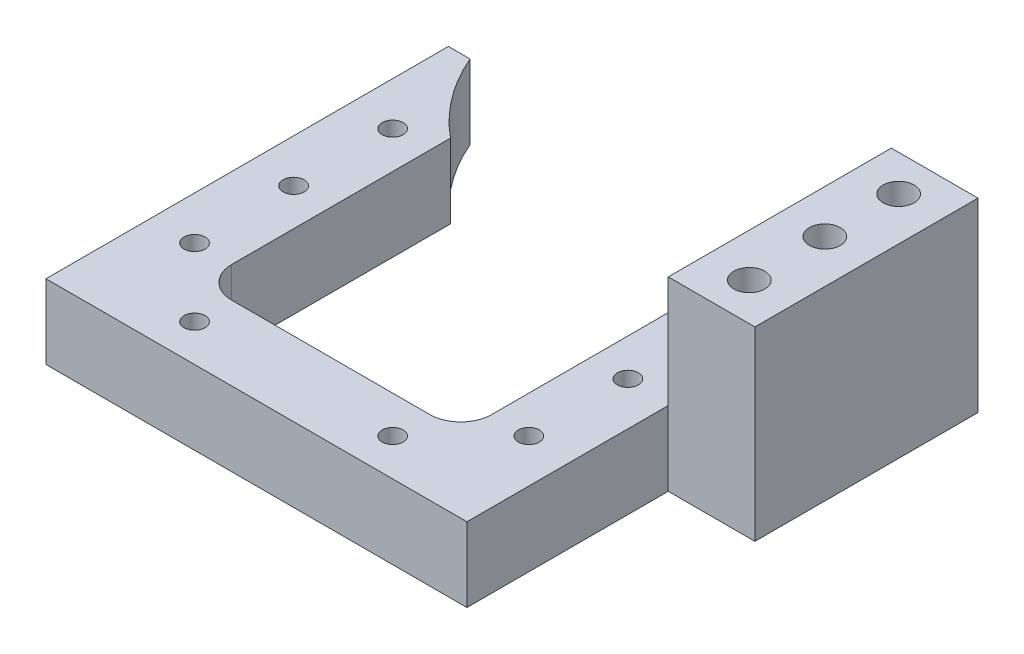
from build123d import *

# Parameters (mm, degrees)
SKETCH1_R           = 0.85
BOSS_EXTRUDE1_DEPTH = 6
BOSS_EXTRUDE2_DEPTH = 15
SKETCH4_R           = 1.25
CUT_EXTRUDE2_DEPTH  = 49.187135213
CUT_EXTRUDE3_DEPTH  = 10
SKETCH7_W           = 1.75
SKETCH7_H           = 1.777688456
BOSS_EXTRUDE4_DEPTH = 6


with BuildPart() as part:
    # Sketch1 → Boss-Extrude1 (new body)
    with BuildSketch(Plane(origin=(0, 0, 0), x_dir=(1, 0, 0), z_dir=(0, 1, 0))):
        with BuildLine():
            Line((-17, -6.5), (-17, -33.5))
            Line((-17, -33.5), (-17, -39))
            Line((-17, -39), (17, -39))
            Line((17, -39), (17, -33.5))
            Line((17, -33.5), (17, -6.5))
            Line((17, -6.5), (15.25, -6.5))
            ThreePointArc((15.25, -6.5), (13.258096668, -9.951651759), (10.5, -12.828191611))
            Line((10.5, -12.828191611), (10.5, -30.5))
            Line((10.5, -30.5), (8, -30.5))
            Line((8, -30.5), (8, -33))
            Line((8, -33), (-8, -33))
            Line((-8, -33), (-8, -30.5))
            Line((-8, -30.5), (-10.5, -30.5))
            Line((-10.5, -30.5), (-10.5, -12.828191611))
            ThreePointArc((-10.5, -12.828191611), (-13.258096668, -9.951651759), (-15.25, -6.5))
            Line((-15.25, -6.5), (-17, -6.5))
        make_face()
        with Locations(Location((-13.5, -30.5, 0), (0, 0, 270))):
            Circle(SKETCH1_R, mode=Mode.SUBTRACT)
        with Locations(Location((-13.5, -22.5, 0), (0, 0, 270))):
            Circle(SKETCH1_R, mode=Mode.SUBTRACT)
        with Locations(Location((-13.5, -14.5, 0), (0, 0, 270))):
            Circle(SKETCH1_R, mode=Mode.SUBTRACT)
        with Locations(Location((-8, -36, 0), (0, 0, 270))):
            Circle(SKETCH1_R, mode=Mode.SUBTRACT)
        with Locations(Location((8, -36, 0), (0, 0, 270))):
            Circle(SKETCH1_R, mode=Mode.SUBTRACT)
        with Locations(Location((13.5, -30.5, 0), (0, 0, 270))):
            Circle(SKETCH1_R, mode=Mode.SUBTRACT)
        with Locations(Location((13.5, -22.5, 0), (0, 0, 270))):
            Circle(SKETCH1_R, mode=Mode.SUBTRACT)
        with Locations(Location((13.5, -14.5, 0), (0, 0, 270))):
            Circle(SKETCH1_R, mode=Mode.SUBTRACT)
    extrude(amount=BOSS_EXTRUDE1_DEPTH)

    # Sketch3 → Boss-Extrude2 (add)
    with BuildSketch(Plane.XZ):
        Polygon((17, 22.74), (24, 22.74), (24, 4.72), (17, 4.72), (17, 7.901808389), align=None)
    extrude(amount=-BOSS_EXTRUDE2_DEPTH)

    # Sketch4 → Cut-Extrude2 (cut, through all)
    with BuildSketch(Plane.XZ):
        with Locations(Location((20.5, 7.63, 0), (0, 0, 270))):
            Circle(SKETCH4_R)
        with Locations(Location((20.5, 13.59, 0), (0, 0, 270))):
            Circle(SKETCH4_R)
        with Locations(Location((20.5, 19.69, 0), (0, 0, 270))):
            Circle(SKETCH4_R)
    extrude(amount=-CUT_EXTRUDE2_DEPTH, mode=Mode.SUBTRACT)

    # Sketch5 → Cut-Extrude3 (cut)
    with BuildSketch(Plane.XZ):
        with BuildLine():
            Line((8, 33), (-8, 33))
            ThreePointArc((-8, 33), (-9.767766953, 32.267766953), (-10.5, 30.5))
            Line((-10.5, 30.5), (10.5, 30.5))
            ThreePointArc((10.5, 30.5), (9.767766953, 32.267766953), (8, 33))
        make_face()
    extrude(amount=-CUT_EXTRUDE3_DEPTH, mode=Mode.SUBTRACT)

    # Sketch7 → Boss-Extrude4 (add)
    with BuildSketch(Plane(origin=(0, 6, 0), x_dir=(1, 0, 0), z_dir=(0, 1, 0))):
        with Locations((16.125, -5.611155772)):
            Rectangle(SKETCH7_W, SKETCH7_H)
    extrude(amount=-BOSS_EXTRUDE4_DEPTH)


solid = part.part
